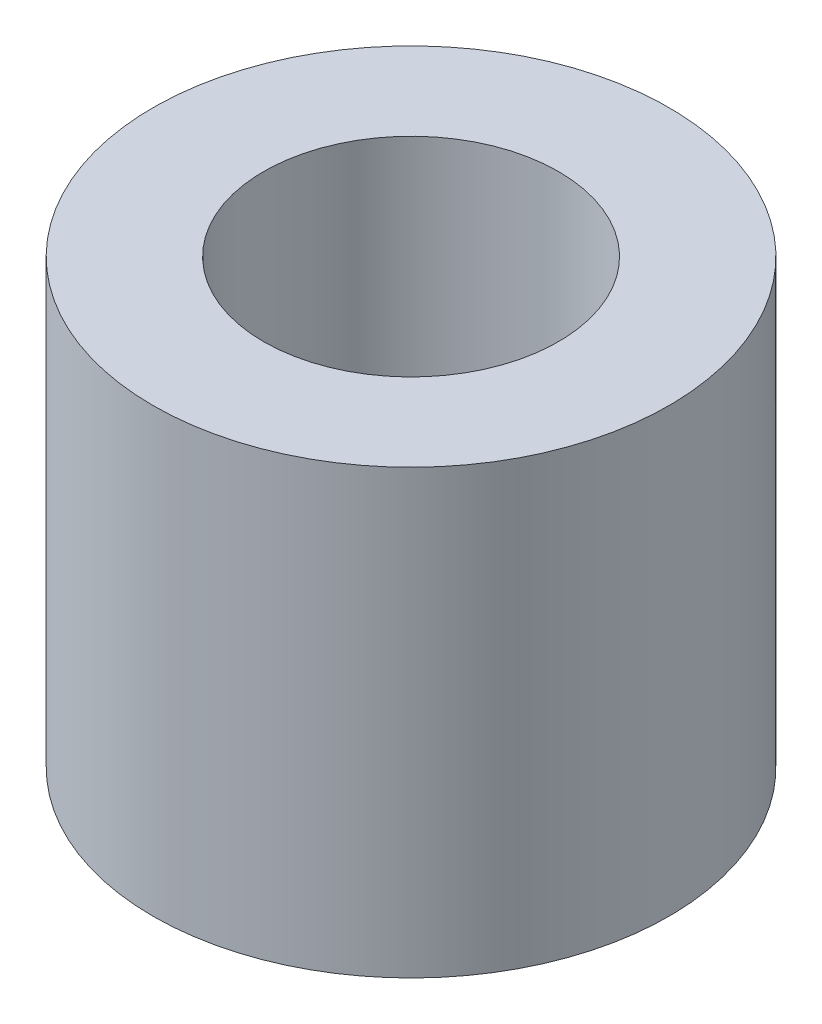
from build123d import *

# Parameters (mm, degrees)
SKETCH_1_R      = 3.5
SKETCH_1_R_2    = 2
EXTRUDE_1_DEPTH = 6


with BuildPart() as part:
    # Эскиз1 → Бобышка-Вытянуть1 (new body)
    with BuildSketch(Plane(origin=(0, 0, 0), x_dir=(1, 0, 0), z_dir=(0, 1, 0))):
        with Locations(Location((0, 0, 0), (0, 0, 270))):
            Circle(SKETCH_1_R)
        with Locations(Location((0, 0, 0), (0, 0, 270))):
            Circle(SKETCH_1_R_2, mode=Mode.SUBTRACT)
    extrude(amount=EXTRUDE_1_DEPTH)


solid = part.part
